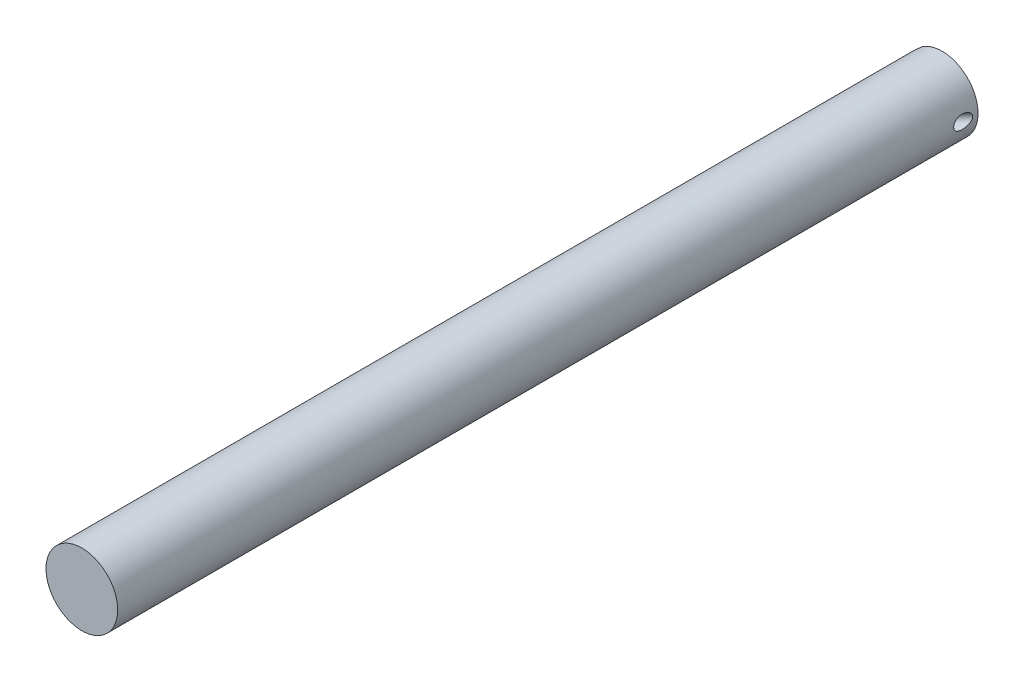
from build123d import *

# Parameters (mm, degrees)
SKETCH1_R                   = 12.7
EXTRUDE1_DEPTH              = 304.8
EXTRUDE2_DEPTH              = 306.328708116
EXTRUDE2_DEPTH_BACK         = 306.328708116
SKETCH4_R                   = 2.38125
SKETCH6_W                   = 20.167016722
SKETCH6_H                   = 37.330359398
EXTRUDE3_DEPTH              = 63.5
F_10_24_TAPPED_HOLE1_REACH  = 305.254
F_10_24_TAPPED_HOLE1_BORE_R = 1.89865
SKETCH10_R                  = 3.96875
EXTRUDE4_DEPTH              = 288.166292049


with BuildPart() as part:
    # Sketch1 → Extrude1 (new body)
    with BuildSketch(Plane.XY):
        with Locations(Location((0, 0, 0), (0, 0, 180))):
            Circle(SKETCH1_R)
    extrude(amount=EXTRUDE1_DEPTH)

    # Sketch4 → Extrude2 (cut, two sides: drawn at the far end of the back side and taken through both)
    with BuildSketch(Plane(origin=(0, 0, 0), x_dir=(0.7071067811865462, 0, 0.7071067811865488), z_dir=(-0.7071067811865488, 0, 0.7071067811865462)).offset(-EXTRUDE2_DEPTH_BACK)):
        with Locations((12.7, 0)):
            Circle(SKETCH4_R)
    extrude(amount=EXTRUDE2_DEPTH + EXTRUDE2_DEPTH_BACK, mode=Mode.SUBTRACT)

    # Sketch6 → Extrude3 (cut)
    with BuildSketch(Plane(origin=(-3.592102448, 0, -3.592102448), x_dir=(-0.7071067811865512, 0, 0.7071067811865438), z_dir=(-0.7071067811865438, 0, -0.7071067811865512))):
        with Locations((5.167476491, 0)):
            Rectangle(SKETCH6_W, SKETCH6_H)
    extrude(amount=EXTRUDE3_DEPTH, mode=Mode.SUBTRACT)

    # #10-24 Tapped Hole1 bore (on position points) → #10-24 Tapped Hole1 (cut, up to next)
    with BuildSketch(Plane(origin=(-9.846920352, -0.244294465, 2.662715455), x_dir=(-0.707106781187, 0, 0.707106781187), z_dir=(-0.707106781187, 0, -0.707106781187)), mode=Mode.PRIVATE) as f_10_24_tapped_hole1_sk1:
        Circle(F_10_24_TAPPED_HOLE1_BORE_R)
    f_10_24_tapped_hole1_tool1 = extrude(f_10_24_tapped_hole1_sk1.sketch, amount=-F_10_24_TAPPED_HOLE1_REACH, mode=Mode.PRIVATE) & part.part
    add(f_10_24_tapped_hole1_tool1.solids().sort_by_distance((-9.84692, -0.244294, 2.662715))[0], mode=Mode.SUBTRACT)

    # Sketch10 → Extrude4 (cut, through all)
    with BuildSketch(Plane(origin=(-19.756563466, 0, 19.756563466), x_dir=(0.7071067811865462, 0, 0.7071067811865488), z_dir=(-0.7071067811865488, 0, 0.7071067811865462))):
        with Locations((12.7, 0)):
            Circle(SKETCH10_R)
    extrude(amount=EXTRUDE4_DEPTH, mode=Mode.SUBTRACT)


solid = part.part
